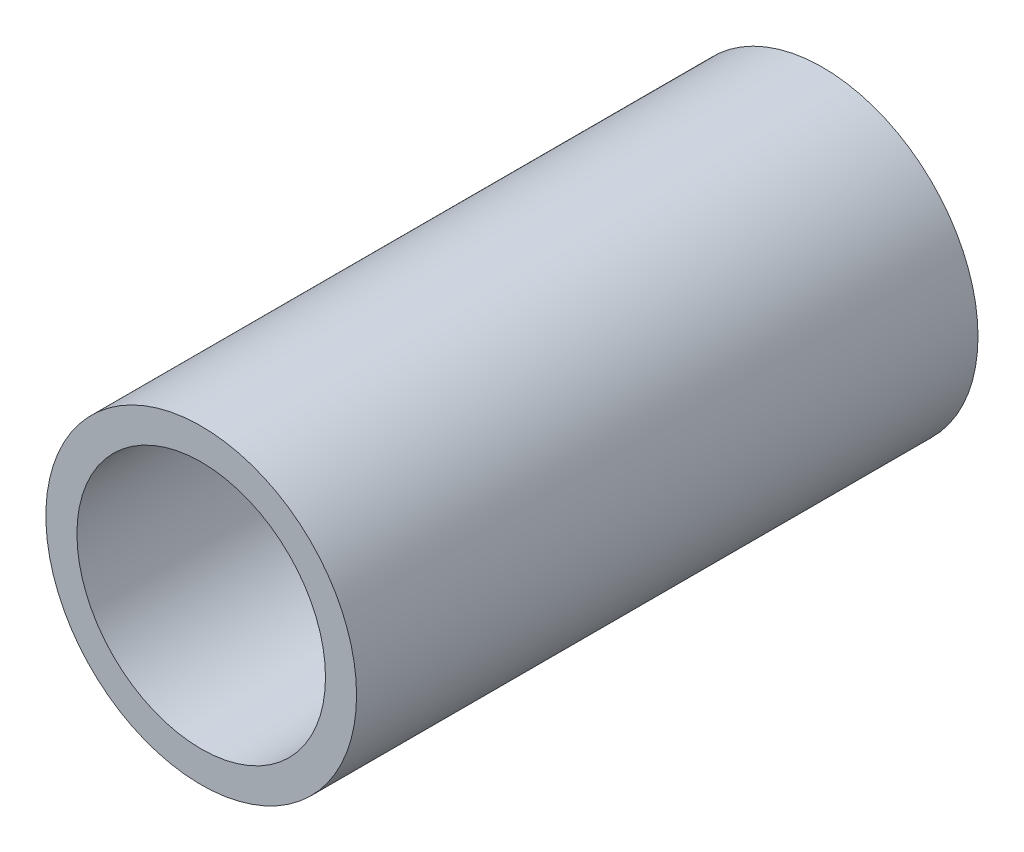
from build123d import *

# Parameters (mm, degrees)
SCHIZZO1_R                   = 5
ESTRUSIONE_ESTRUSIONE1_DEPTH = 20
SCHIZZO2_R                   = 4
TAGLIO_ESTRUSIONE1_DEPTH     = 18


with BuildPart() as part:
    # Schizzo1 → Estrusione-Estrusione1 (new body)
    with BuildSketch(Plane.XY):
        Circle(SCHIZZO1_R)
    extrude(amount=ESTRUSIONE_ESTRUSIONE1_DEPTH)

    # Schizzo2 → Taglio-Estrusione1 (cut)
    with BuildSketch(Plane.XY.offset(20)):
        Circle(SCHIZZO2_R)
    extrude(amount=-TAGLIO_ESTRUSIONE1_DEPTH, mode=Mode.SUBTRACT)


solid = part.part
